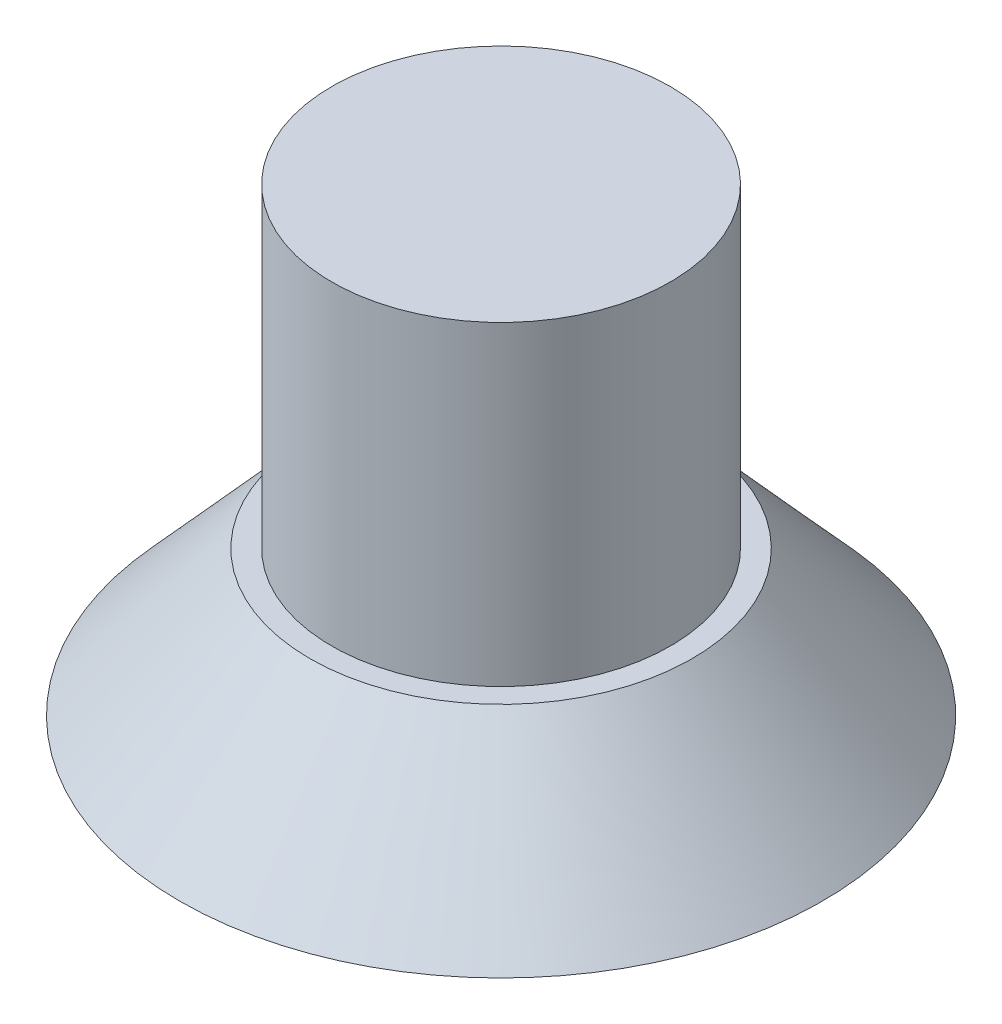
from build123d import *

# Parameters (mm, degrees)
SKETCH2_R           = 3.3274
BOSS_EXTRUDE1_DEPTH = 1.4986
BOSS_EXTRUDE1_TAPER = 42
SKETCH3_R           = 1.7526
BOSS_EXTRUDE2_DEPTH = 3.2639


with BuildPart() as part:
    # Sketch2 → Boss-Extrude1 (new body)
    with BuildSketch(Plane(origin=(0, 0, 0), x_dir=(1, 0, 0), z_dir=(0, 1, 0))):
        Circle(SKETCH2_R)
    extrude(amount=BOSS_EXTRUDE1_DEPTH, taper=BOSS_EXTRUDE1_TAPER)

    # Sketch3 → Boss-Extrude2 (add)
    with BuildSketch(Plane(origin=(0, 1.4986, 0), x_dir=(1, 0, 0), z_dir=(0, 1, 0))):
        with Locations(Location((0, 0, 0), (0, 0, 90))):
            Circle(SKETCH3_R)
    extrude(amount=BOSS_EXTRUDE2_DEPTH)


solid = part.part
